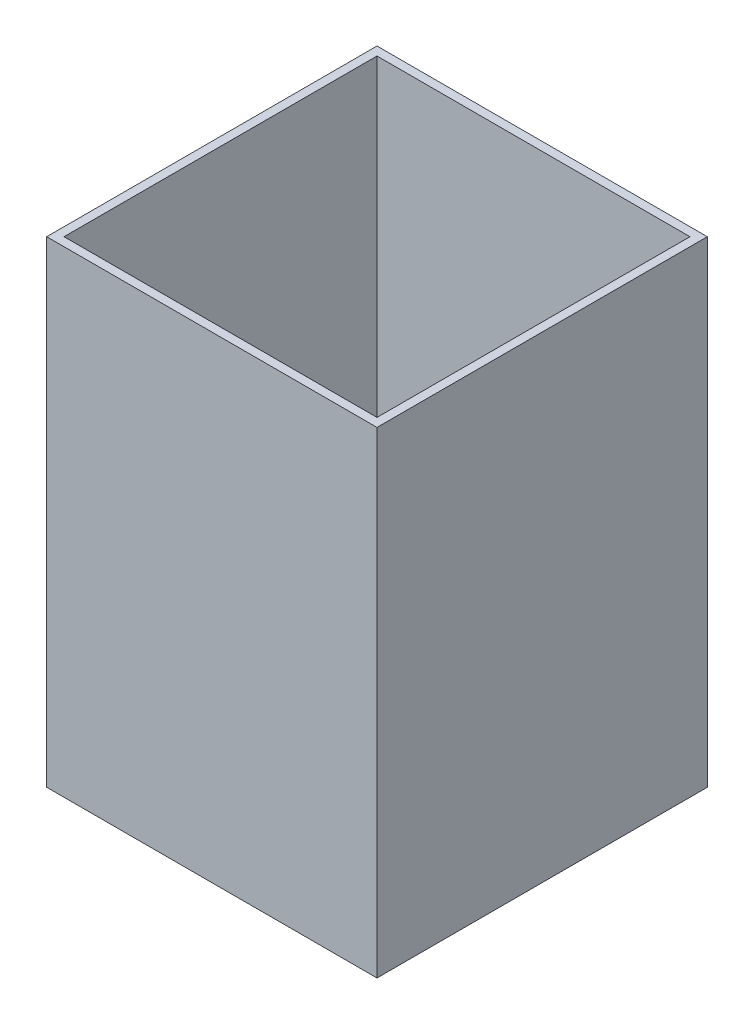
from build123d import *

# Parameters (mm, degrees)
SKETCH1_W           = 76.2
SKETCH1_H           = 76.2
SKETCH1_W_2         = 72.2
SKETCH1_H_2         = 72.2
BOSS_EXTRUDE1_DEPTH = 110


with BuildPart() as part:
    # Sketch1 → Boss-Extrude1 (new body)
    with BuildSketch(Plane(origin=(0, 0, 0), x_dir=(1, 0, 0), z_dir=(0, 1, 0))):
        with Locations((38.1, 38.1)):
            Rectangle(SKETCH1_W, SKETCH1_H)
        with Locations((38.1, 38.1)):
            Rectangle(SKETCH1_W_2, SKETCH1_H_2, mode=Mode.SUBTRACT)
    extrude(amount=BOSS_EXTRUDE1_DEPTH)


solid = part.part
